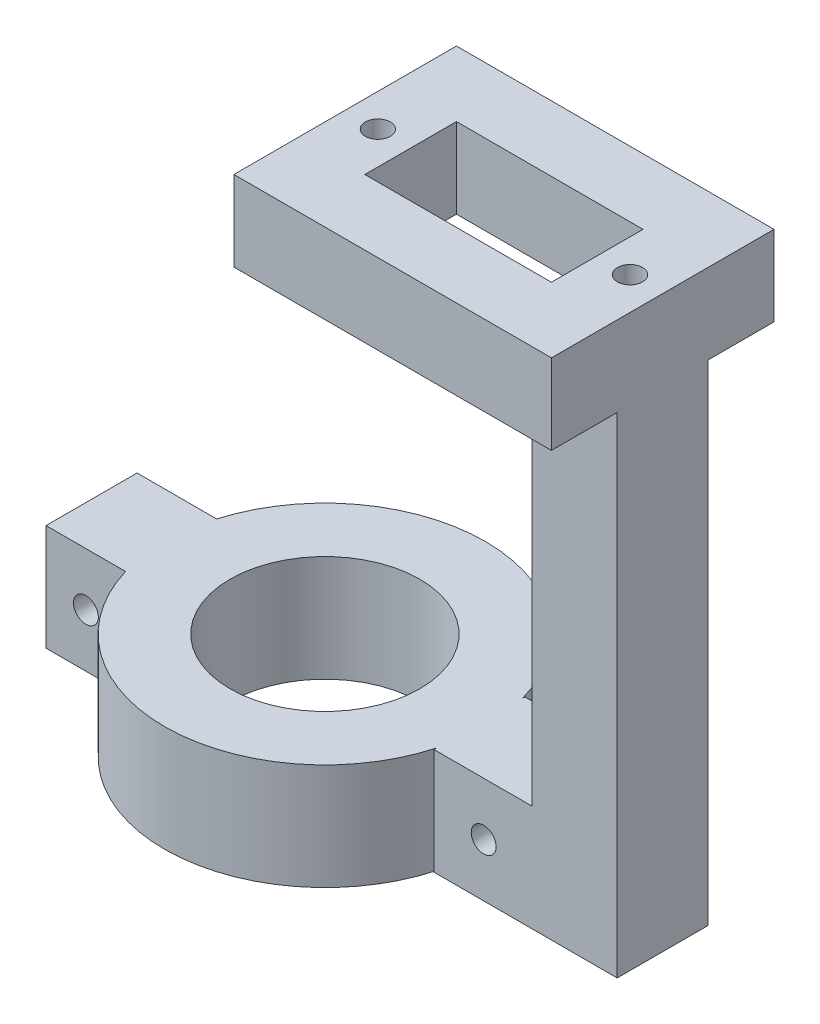
from build123d import *

# Parameters (mm, degrees)
SKETCH_1_W           = 48.51
SKETCH_1_H           = 34
SKETCH_1_W_2         = 28.51
SKETCH_1_H_2         = 14
EXTRUDE_1_DEPTH      = 12.25
SKETCH_2_R           = 1.91
CUT_EXTRUDE_1_DEPTH  = 33.05257439
SKETCH_4_W           = 13
SKETCH_4_H           = 13.91
EXTRUDE_1_2_DEPTH    = 74.82
SKETCH_5_W           = 13.91
SKETCH_5_H           = 16.23
EXTRUDE_2_DEPTH      = 15
SKETCH_7_R           = 24.5
SKETCH_7_R_2         = 14.5
EXTRUDE_2_2_DEPTH    = 16.23
SKETCH_12_R          = 1.9
CUT_EXTRUDE_4_DEPTH  = 97.312124675
EXTRUDE_3_DEPTH      = 10
EXTRUDE_3_DEPTH_BACK = 8
SKETCH_13_W          = 13.91
SKETCH_13_H          = 16.23
SKETCH_14_R          = 1.9
CUT_EXTRUDE_5_DEPTH  = 103.744583434


with BuildPart() as part:
    # 草圖1 → Extrude 1 (new body)
    with BuildSketch(Plane(origin=(0, 0, 0), x_dir=(1, 0, 0), z_dir=(0, 1, 0))):
        Rectangle(SKETCH_1_W, SKETCH_1_H)
        Rectangle(SKETCH_1_W_2, SKETCH_1_H_2, mode=Mode.SUBTRACT)
    extrude(amount=EXTRUDE_1_DEPTH)

    # 草圖2 → 除料-伸長1 (cut, through all)
    with BuildSketch(Plane(origin=(0, 12.25, 0), x_dir=(1, 0, 0), z_dir=(0, 1, 0))):
        with Locations(Location((-19.255, 0, 0), (0, 0, 270))):
            Circle(SKETCH_2_R)
        with Locations(Location((19.255, 0, 0), (0, 0, 270))):
            Circle(SKETCH_2_R)
    extrude(amount=-CUT_EXTRUDE_1_DEPTH, mode=Mode.SUBTRACT)

    # 草圖4 → Extrude 1 2 (add)
    with BuildSketch(Plane.XZ):
        with Locations((17.755, 0)):
            Rectangle(SKETCH_4_W, SKETCH_4_H)
    extrude(amount=EXTRUDE_1_2_DEPTH)

    # 草圖5 → Extrude 2 (add)
    with BuildSketch(Plane.ZY.offset(-11.255)):
        with Locations((0, -66.705)):
            Rectangle(SKETCH_5_W, SKETCH_5_H)
    extrude(amount=EXTRUDE_2_DEPTH)

    # 草圖7 → Extrude 2 2 (add)
    with BuildSketch(Plane(origin=(3.626674765, -74.82, 0), x_dir=(1, 0, 0), z_dir=(0, -1, 0))):
        with Locations((-30.978154344, 0)):
            Circle(SKETCH_7_R)
        with Locations((-30.978154344, 0)):
            Circle(SKETCH_7_R_2, mode=Mode.SUBTRACT)
    extrude(amount=-EXTRUDE_2_2_DEPTH)

    # 草圖12 → 除料-伸長4 (cut, through all)
    with BuildSketch(Plane(origin=(0, 0, -6.955), x_dir=(-1, 0, 0), z_dir=(0, 0, -1))):
        with Locations((-3.856713649, -66.705)):
            Circle(SKETCH_12_R)
    extrude(amount=-CUT_EXTRUDE_4_DEPTH, mode=Mode.SUBTRACT)

    # 草圖13 → 填料-伸長3 (add, two sides: drawn at the far end of the back side and taken through both)
    with BuildSketch(Plane(origin=(-55, 0, 0), x_dir=(0, 0, -1), z_dir=(1, 0, 0)).offset(-EXTRUDE_3_DEPTH_BACK)):
        with Locations((0, -66.705)):
            Rectangle(SKETCH_13_W, SKETCH_13_H)
    extrude(amount=EXTRUDE_3_DEPTH + EXTRUDE_3_DEPTH_BACK)

    # 草圖14 → 除料-伸長5 (cut, through all)
    with BuildSketch(Plane(origin=(0, 0, -6.955), x_dir=(-1, 0, 0), z_dir=(0, 0, -1))):
        with Locations((56.908040017, -66.705)):
            Circle(SKETCH_14_R)
    extrude(amount=-CUT_EXTRUDE_5_DEPTH, mode=Mode.SUBTRACT)


solid = part.part
